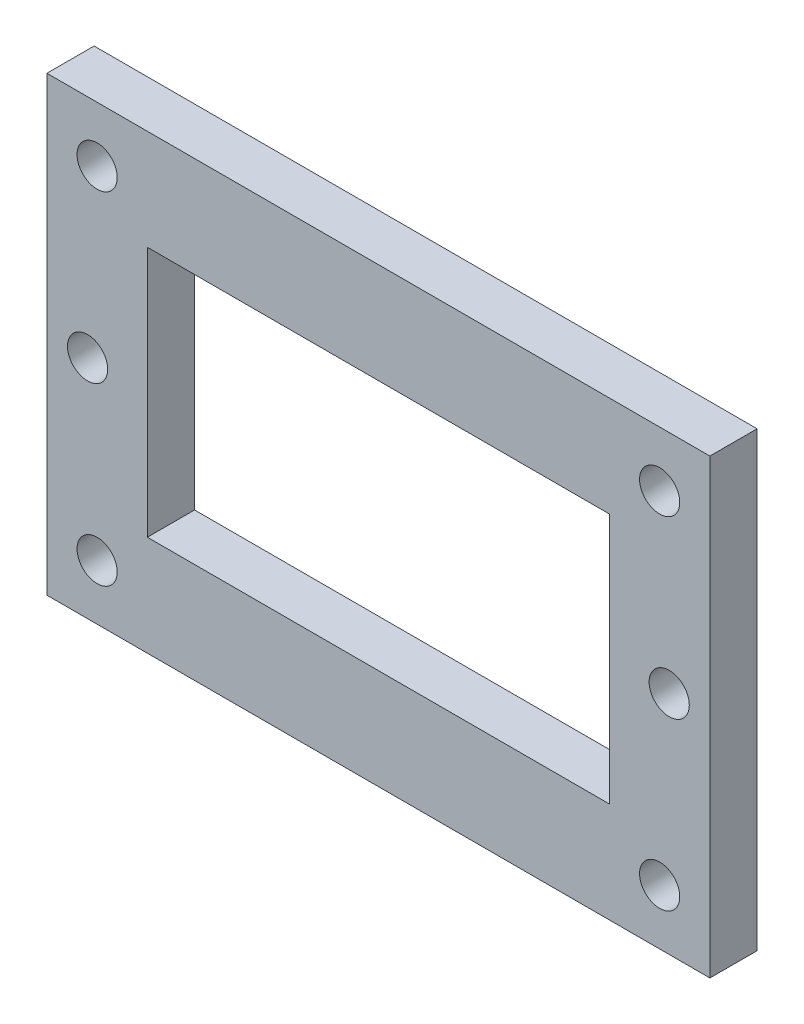
from build123d import *

# Parameters (mm, degrees)
SCHIZZO1_W                   = 33
SCHIZZO1_H                   = 22.5
SCHIZZO1_W_2                 = 23
SCHIZZO1_H_2                 = 12.5
ESTRUSIONE_ESTRUSIONE1_DEPTH = 2.35
SCHIZZO2_R                   = 1
TAGLIO_ESTRUSIONE1_DEPTH     = 2.35
SPECCHIA2_COPY_1_SKETCH_R    = 1
SPECCHIA2_COPY_1_DEPTH       = 2.35
SCHIZZO3_R                   = 1
TAGLIO_ESTRUSIONE2_DEPTH     = 2.35


with BuildPart() as part:
    # Schizzo1 → Estrusione-Estrusione1 (new body)
    with BuildSketch(Plane.XY):
        Rectangle(SCHIZZO1_W, SCHIZZO1_H)
        Rectangle(SCHIZZO1_W_2, SCHIZZO1_H_2, mode=Mode.SUBTRACT)
    extrude(amount=ESTRUSIONE_ESTRUSIONE1_DEPTH)

    # Schizzo2 → Taglio-Estrusione1 (cut)
    with BuildSketch(Plane.XY.offset(2.35)):
        with Locations((-14, 8.5)):
            Circle(SCHIZZO2_R)
    taglio_estrusione1 = extrude(amount=-TAGLIO_ESTRUSIONE1_DEPTH, mode=Mode.SUBTRACT)

    # Specchia1: Taglio-Estrusione1 across plane
    add(taglio_estrusione1.mirror(Plane.ZX), mode=Mode.SUBTRACT)

    # Specchia2: Taglio-Estrusione1 across plane
    add(taglio_estrusione1.mirror(Plane(origin=(0, 0, 0), x_dir=(0, 0, 1), z_dir=(1, 0, 0))), mode=Mode.SUBTRACT)

    # Specchia2 copy 1 sketch → Specchia2 copy 1 (cut)
    with BuildSketch(Plane(origin=(0, 0, 2.35), x_dir=(-1, 0, 0), z_dir=(0, 0, 1))):
        with Locations((-14, 8.5)):
            Circle(SPECCHIA2_COPY_1_SKETCH_R)
    extrude(amount=-SPECCHIA2_COPY_1_DEPTH, mode=Mode.SUBTRACT)

    # Schizzo3 → Taglio-Estrusione2 (cut)
    with BuildSketch(Plane.XY.offset(2.35)):
        with Locations((14.475, 0)):
            Circle(SCHIZZO3_R)
    taglio_estrusione2 = extrude(amount=-TAGLIO_ESTRUSIONE2_DEPTH, mode=Mode.SUBTRACT)

    # Specchia3: Taglio-Estrusione2 across plane
    add(taglio_estrusione2.mirror(Plane(origin=(0, 0, 0), x_dir=(0, 0, 1), z_dir=(1, 0, 0))), mode=Mode.SUBTRACT)


solid = part.part
